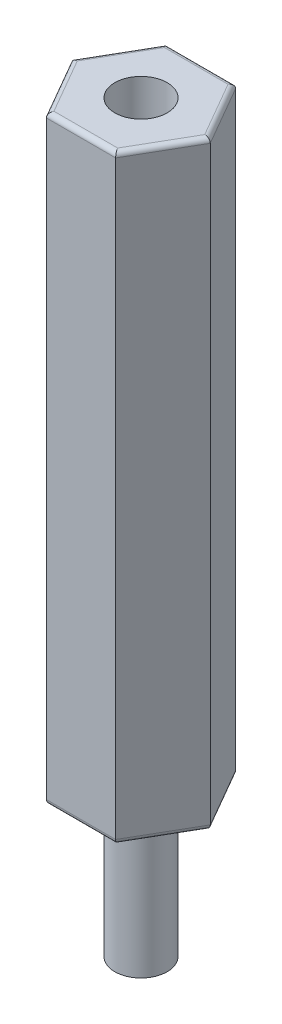
from build123d import *

# Parameters (mm, degrees)
RESSALTO_EXTRUS_O1_DEPTH = 25
FILETE1_R                = 0.2
ESBO_O2_R                = 1.0922
RESSALTO_EXTRUS_O2_DEPTH = 6
ESBO_O3_R                = 1.0922
CORTE_EXTRUS_O1_DEPTH    = 4.76


with BuildPart() as part:
    # Esboço1 → Ressalto-extrusão1 (new body)
    with BuildSketch(Plane(origin=(0, 0, 0), x_dir=(1, 0, 0), z_dir=(0, 1, 0))):
        Polygon((2.886751346, 0), (1.443375673, 2.5), (-1.443375673, 2.5), (-2.886751346, 0), (-1.443375673, -2.5), (1.443375673, -2.5), align=None)
    extrude(amount=RESSALTO_EXTRUS_O1_DEPTH)

    # Filete1
    filete1_edges = [part.edges().sort_by_distance(p)[0] for p in [
        (0, 25, -2.5),
        (-2.165063509, 25, -1.25),
        (-2.165063509, 25, 1.25),
        (0, 25, 2.5),
        (2.165063509, 25, 1.25),
        (0, 0, 2.5),
        (-2.165063509, 0, 1.25),
        (-2.165063509, 0, -1.25),
        (2.165063509, 25, -1.25),
        (0, 0, -2.5),
        (2.165063509, 0, -1.25),
        (2.165063509, 0, 1.25),
    ]]
    fillet(filete1_edges, radius=FILETE1_R)

    # Esboço2 → Ressalto-extrusão2 (add)
    with BuildSketch(Plane.XZ):
        with Locations(Location((0, 0, 0), (0, 0, 90))):
            Circle(ESBO_O2_R)
    extrude(amount=RESSALTO_EXTRUS_O2_DEPTH)

    # Esboço3 → Corte-extrusão1 (cut)
    with BuildSketch(Plane(origin=(0, 25, 0), x_dir=(1, 0, 0), z_dir=(0, 1, 0))):
        with Locations(Location((0, 0, 0), (0, 0, 270))):
            Circle(ESBO_O3_R)
    extrude(amount=-CORTE_EXTRUS_O1_DEPTH, mode=Mode.SUBTRACT)


solid = part.part
